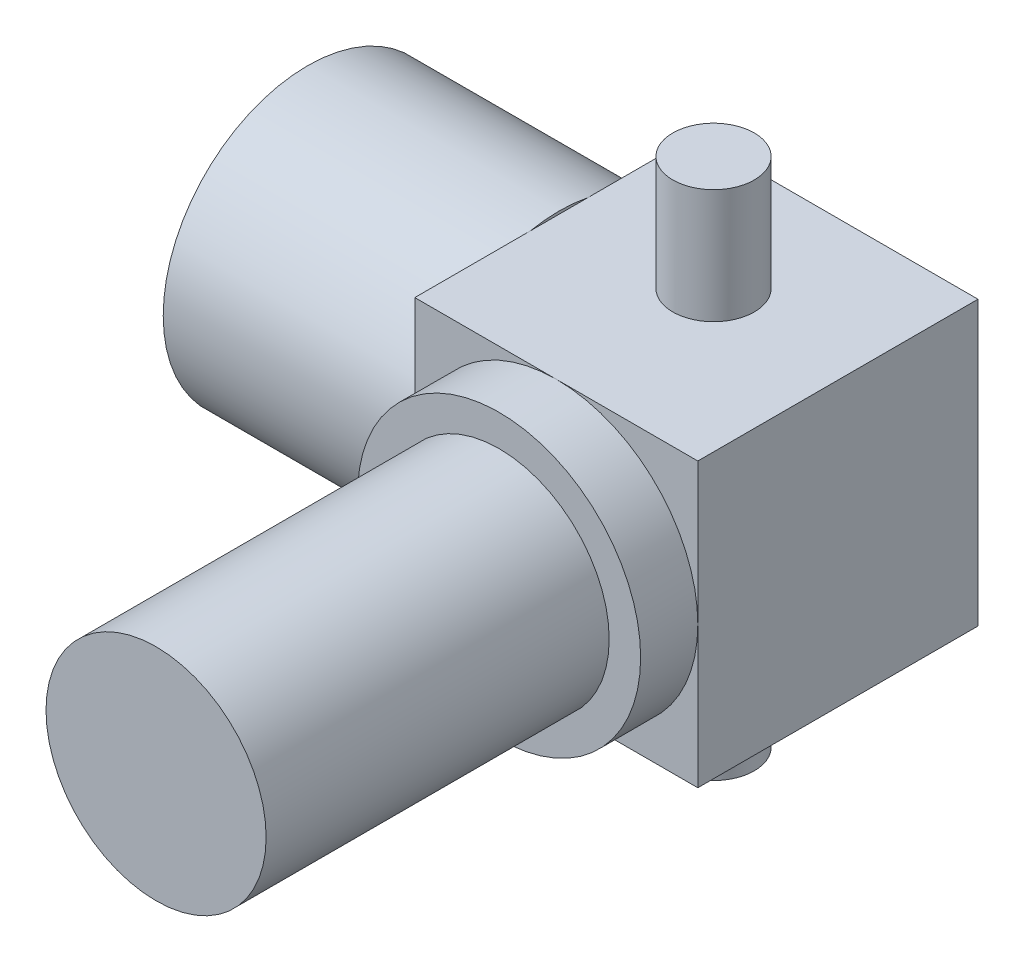
from build123d import *

# Parameters (mm, degrees)
SKETCH1_W           = 25.146
SKETCH1_H           = 25.146
BOSS_EXTRUDE1_DEPTH = 24.892
BOSS_EXTRUDE2_DEPTH = 5.08
SKETCH3_R           = 9.779
BOSS_EXTRUDE3_DEPTH = 30.48
SKETCH4_R           = 12.827
BOSS_EXTRUDE4_DEPTH = 22.352
SKETCH5_R           = 3.6195
BOSS_EXTRUDE5_DEPTH = 10.16
BOSS_EXTRUDE6_START = 10.16
SKETCH6_R           = 3.6195
BOSS_EXTRUDE6_DEPTH = 10.16


with BuildPart() as part:
    # Sketch1 → Boss-Extrude1 (new body)
    with BuildSketch(Plane.XY):
        with Locations((-15.408088235, -0.246529412)):
            Rectangle(SKETCH1_W, SKETCH1_H)
    extrude(amount=BOSS_EXTRUDE1_DEPTH)

    # Sketch2 → Boss-Extrude2 (add)
    with BuildSketch(Plane.XY.offset(24.892)):
        with BuildLine():
            ThreePointArc((-2.835088235, -0.246529412), (-6.517634675, 8.643924148), (-15.408088235, 12.326470588))
            Line((-15.408088235, 12.326470588), (-15.408088235, -0.246529412))
            Line((-15.408088235, -0.246529412), (-2.835088235, -0.246529412))
        make_face()
        with BuildLine():
            Line((-15.408088235, -0.246529412), (-15.408088235, 12.326470588))
            ThreePointArc((-15.408088235, 12.326470588), (-24.298541795, 8.643924148), (-27.981088235, -0.246529412))
            Line((-27.981088235, -0.246529412), (-15.408088235, -0.246529412))
        make_face()
        with BuildLine():
            Line((-2.835088235, -0.246529412), (-15.408088235, -0.246529412))
            Line((-15.408088235, -0.246529412), (-15.408088235, -12.819529412))
            ThreePointArc((-15.408088235, -12.819529412), (-6.517634675, -9.136982972), (-2.835088235, -0.246529412))
        make_face()
        with BuildLine():
            Line((-15.408088235, -12.819529412), (-15.408088235, -0.246529412))
            Line((-15.408088235, -0.246529412), (-27.981088235, -0.246529412))
            ThreePointArc((-27.981088235, -0.246529412), (-24.298541795, -9.136982972), (-15.408088235, -12.819529412))
        make_face()
        with BuildLine():
            ThreePointArc((-2.835088235, -0.246529412), (-6.517634675, 8.643924148), (-15.408088235, 12.326470588))
            Line((-15.408088235, 12.326470588), (-15.408088235, -0.246529412))
            Line((-15.408088235, -0.246529412), (-2.835088235, -0.246529412))
        make_face()
        with BuildLine():
            Line((-15.408088235, -0.246529412), (-15.408088235, 12.326470588))
            ThreePointArc((-15.408088235, 12.326470588), (-24.298541795, 8.643924148), (-27.981088235, -0.246529412))
            Line((-27.981088235, -0.246529412), (-15.408088235, -0.246529412))
        make_face()
        with BuildLine():
            Line((-2.835088235, -0.246529412), (-15.408088235, -0.246529412))
            Line((-15.408088235, -0.246529412), (-15.408088235, -12.819529412))
            ThreePointArc((-15.408088235, -12.819529412), (-6.517634675, -9.136982972), (-2.835088235, -0.246529412))
        make_face()
        with BuildLine():
            Line((-15.408088235, -12.819529412), (-15.408088235, -0.246529412))
            Line((-15.408088235, -0.246529412), (-27.981088235, -0.246529412))
            ThreePointArc((-27.981088235, -0.246529412), (-24.298541795, -9.136982972), (-15.408088235, -12.819529412))
        make_face()
        with BuildLine():
            ThreePointArc((-2.835088235, -0.246529412), (-6.517634675, 8.643924148), (-15.408088235, 12.326470588))
            Line((-15.408088235, 12.326470588), (-15.408088235, -0.246529412))
            Line((-15.408088235, -0.246529412), (-2.835088235, -0.246529412))
        make_face()
        with BuildLine():
            Line((-15.408088235, -0.246529412), (-15.408088235, 12.326470588))
            ThreePointArc((-15.408088235, 12.326470588), (-24.298541795, 8.643924148), (-27.981088235, -0.246529412))
            Line((-27.981088235, -0.246529412), (-15.408088235, -0.246529412))
        make_face()
        with BuildLine():
            Line((-2.835088235, -0.246529412), (-15.408088235, -0.246529412))
            Line((-15.408088235, -0.246529412), (-15.408088235, -12.819529412))
            ThreePointArc((-15.408088235, -12.819529412), (-6.517634675, -9.136982972), (-2.835088235, -0.246529412))
        make_face()
        with BuildLine():
            Line((-15.408088235, -12.819529412), (-15.408088235, -0.246529412))
            Line((-15.408088235, -0.246529412), (-27.981088235, -0.246529412))
            ThreePointArc((-27.981088235, -0.246529412), (-24.298541795, -9.136982972), (-15.408088235, -12.819529412))
        make_face()
        with BuildLine():
            ThreePointArc((-2.835088235, -0.246529412), (-6.517634675, 8.643924148), (-15.408088235, 12.326470588))
            Line((-15.408088235, 12.326470588), (-15.408088235, -0.246529412))
            Line((-15.408088235, -0.246529412), (-2.835088235, -0.246529412))
        make_face()
        with BuildLine():
            Line((-15.408088235, -0.246529412), (-15.408088235, 12.326470588))
            ThreePointArc((-15.408088235, 12.326470588), (-24.298541795, 8.643924148), (-27.981088235, -0.246529412))
            Line((-27.981088235, -0.246529412), (-15.408088235, -0.246529412))
        make_face()
        with BuildLine():
            Line((-2.835088235, -0.246529412), (-15.408088235, -0.246529412))
            Line((-15.408088235, -0.246529412), (-15.408088235, -12.819529412))
            ThreePointArc((-15.408088235, -12.819529412), (-6.517634675, -9.136982972), (-2.835088235, -0.246529412))
        make_face()
        with BuildLine():
            Line((-15.408088235, -12.819529412), (-15.408088235, -0.246529412))
            Line((-15.408088235, -0.246529412), (-27.981088235, -0.246529412))
            ThreePointArc((-27.981088235, -0.246529412), (-24.298541795, -9.136982972), (-15.408088235, -12.819529412))
        make_face()
    extrude(amount=BOSS_EXTRUDE2_DEPTH)

    # Sketch3 → Boss-Extrude3 (add)
    with BuildSketch(Plane.XY.offset(29.972)):
        with Locations(Location((-15.408088235, -0.246529412, 0), (0, 0, 180))):
            Circle(SKETCH3_R)
    extrude(amount=BOSS_EXTRUDE3_DEPTH)

    # Sketch4 → Boss-Extrude4 (add)
    with BuildSketch(Plane.ZY.offset(27.981088235)):
        with Locations((12.065, -0.246529412)):
            Circle(SKETCH4_R)
    extrude(amount=BOSS_EXTRUDE4_DEPTH)

    # Sketch5 → Boss-Extrude5 (add)
    with BuildSketch(Plane.XZ.offset(12.819529412)):
        with Locations(Location((-15.408088235, 10.922, 0), (0, 0, 90))):
            Circle(SKETCH5_R)
    extrude(amount=BOSS_EXTRUDE5_DEPTH)

    # Sketch6 → Boss-Extrude6 (add)
    with BuildSketch(Plane(origin=(0, 12.326470588, 0), x_dir=(1, 0, 0), z_dir=(0, 1, 0)).offset(BOSS_EXTRUDE6_START)):
        with Locations(Location((-15.408088235, -10.922, 0), (0, 0, 270))):
            Circle(SKETCH6_R)
    extrude(amount=-BOSS_EXTRUDE6_DEPTH)


solid = part.part
